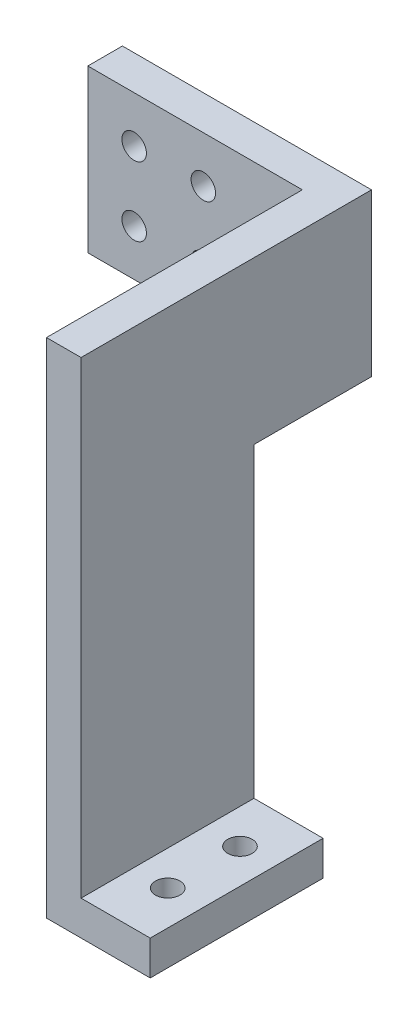
from build123d import *

# Parameters (mm, degrees)
SKETCH1_W            = 19.05
SKETCH1_H            = 31.75
EXTRUDE1_DEPTH       = 6.35
SKETCH3_W            = 6.35
SKETCH3_H            = 31.75
EXTRUDE2_DEPTH       = 85.9886012
SKETCH4_W            = 6.35
SKETCH4_H            = 29.718
EXTRUDE3_DEPTH       = 21.59
SKETCH5_W            = 6.35
SKETCH5_H            = 29.718
EXTRUDE4_DEPTH       = 39.399
M4_CLEARANCE_HOLE1_D = 4.5
M4_CLEARANCE_HOLE2_D = 4.5


with BuildPart() as part:
    # Sketch1 → Extrude1 (new body)
    with BuildSketch(Plane(origin=(0, 0, 0), x_dir=(1, 0, 0), z_dir=(0, 1, 0))):
        Rectangle(SKETCH1_W, SKETCH1_H)
    extrude(amount=EXTRUDE1_DEPTH)

    # Sketch3 → Extrude2 (add)
    with BuildSketch(Plane(origin=(0, 6.35, 0), x_dir=(1, 0, 0), z_dir=(0, 1, 0))):
        with Locations((-6.35, 0)):
            Rectangle(SKETCH3_W, SKETCH3_H)
    extrude(amount=EXTRUDE2_DEPTH)

    # Sketch4 → Extrude3 (add)
    with BuildSketch(Plane(origin=(0, 0, -15.875), x_dir=(-1, 0, 0), z_dir=(0, 0, -1))):
        with Locations((6.35, 77.4796012)):
            Rectangle(SKETCH4_W, SKETCH4_H)
    extrude(amount=EXTRUDE3_DEPTH)

    # Sketch5 → Extrude4 (add)
    with BuildSketch(Plane.ZY.offset(9.525)):
        with Locations((-34.29, 77.4796012)):
            Rectangle(SKETCH5_W, SKETCH5_H)
    extrude(amount=EXTRUDE4_DEPTH)

    # M4 Clearance Hole1 (through all)
    with Locations(Plane(origin=(30.89, -14.85899888, -37.465), x_dir=(-1, 0, 0), z_dir=(0, 0, -1))):
        with Locations((71.305, 85.98860008), (58.605, 85.98860008), (58.605, 98.68860008), (71.305, 98.68860008)):
            Hole(M4_CLEARANCE_HOLE1_D / 2)

    # M4 Clearance Hole2 (through all)
    with Locations(Plane(origin=(0, 6.35, 0), x_dir=(-1, 0, 0), z_dir=(0, 1, 0))):
        with Locations((-3.175, 6.313141271), (-3.175, -6.956578863)):
            Hole(M4_CLEARANCE_HOLE2_D / 2)


solid = part.part
